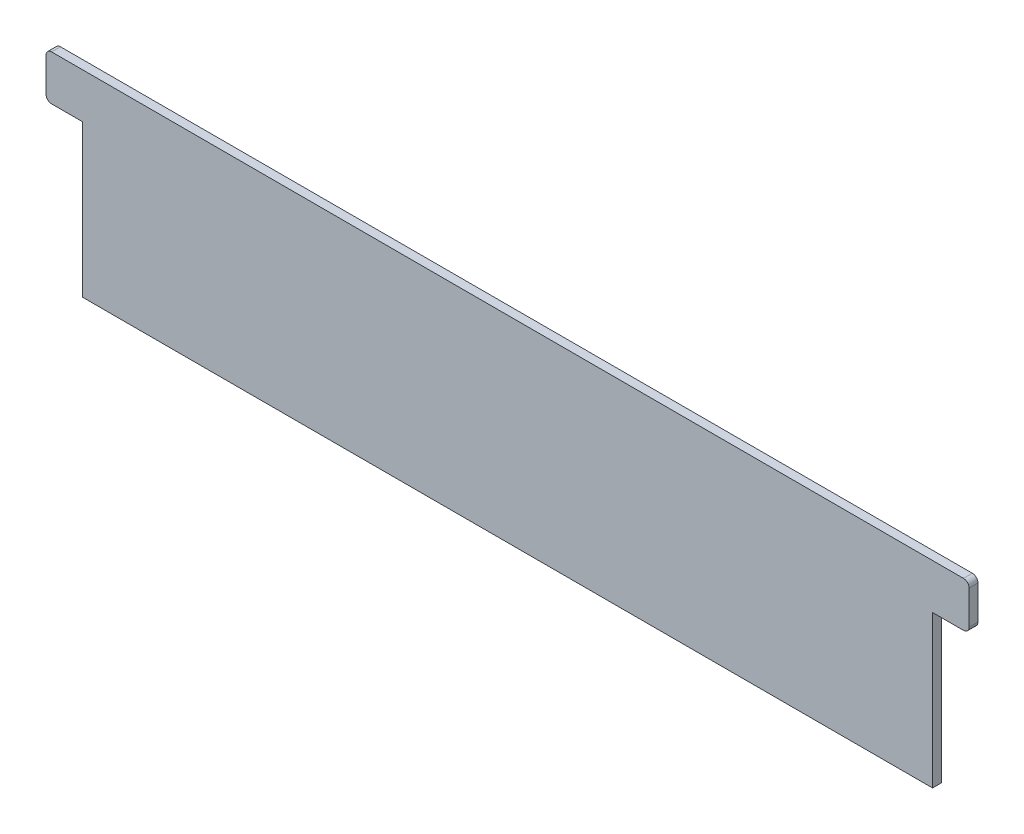
from build123d import *

# Parameters (mm, degrees)
BOSS_EXTRUDE1_DEPTH = 2.5
FILLET1_R           = 3.175


with BuildPart() as part:
    # Sketch1 → Boss-Extrude1 (new, symmetric)
    with BuildSketch(Plane.XY):
        Polygon((-260.35, 68.2625), (260.35, 68.2625), (260.35, 42.8625), (239.7125, 42.8625), (239.7125, -42.8625), (-239.7125, -42.8625), (-239.7125, 42.8625), (-260.35, 42.8625), align=None)
    extrude(amount=BOSS_EXTRUDE1_DEPTH, both=True)

    # Fillet1
    fillet1_edges = [part.edges().sort_by_distance(p)[0] for p in [
        (-260.35, 68.2625, 0),
        (260.35, 68.2625, 0),
        (260.35, 42.8625, 0),
        (-260.35, 42.8625, 0),
    ]]
    fillet(fillet1_edges, radius=FILLET1_R)


solid = part.part
